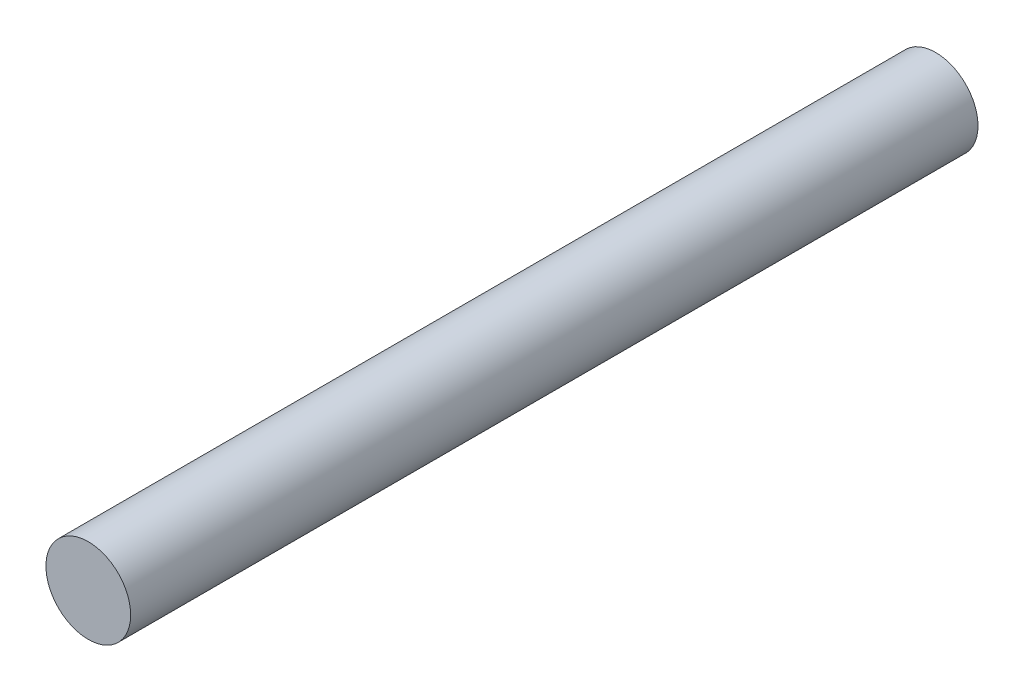
from build123d import *

# Parameters (mm, degrees)
ESQUISSE1_R        = 25
BOSS_EXTRU_1_DEPTH = 500


with BuildPart() as part:
    # Esquisse1 → Boss.-Extru.1 (new body)
    with BuildSketch(Plane.XY):
        Circle(ESQUISSE1_R)
    extrude(amount=BOSS_EXTRU_1_DEPTH)


solid = part.part
